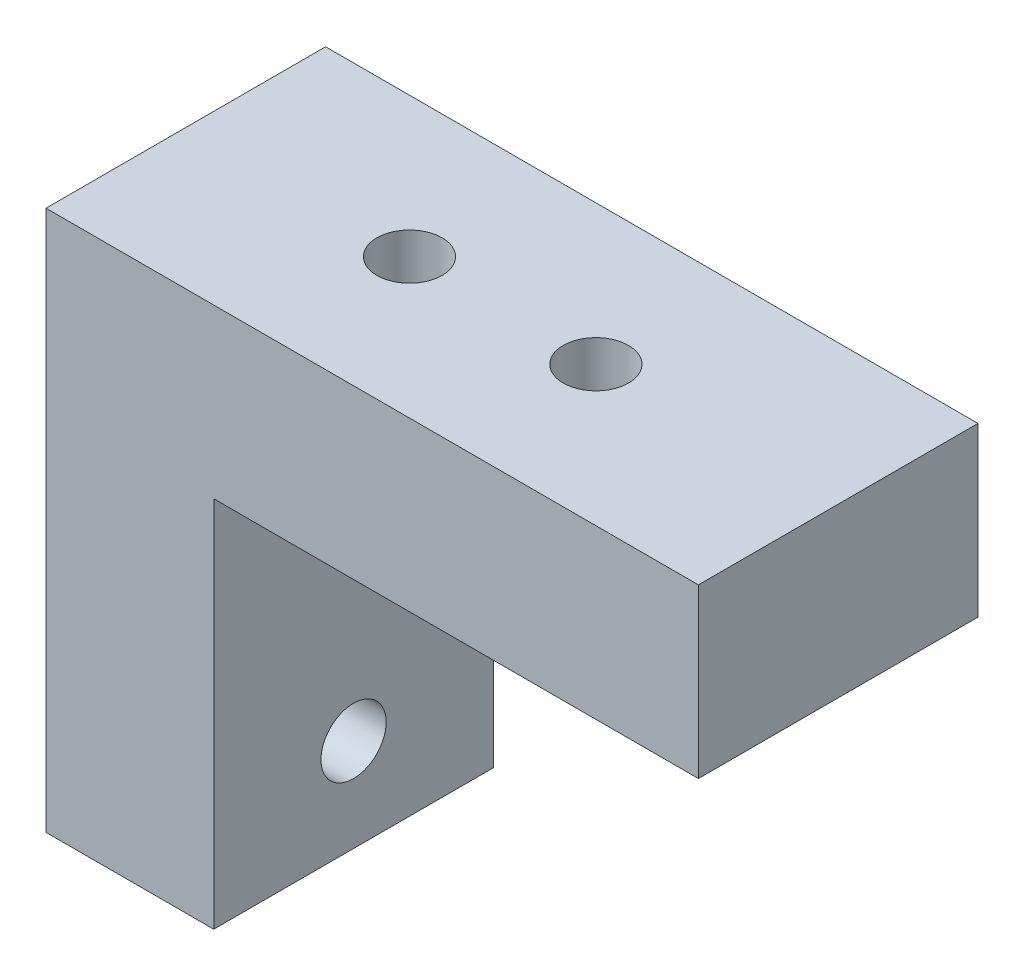
from build123d import *

# Parameters (mm, degrees)
SKETCH2_W           = 15
SKETCH2_H           = 20
BOSS_EXTRUDE1_DEPTH = 9
SKETCH3_R           = 1.75
CUT_EXTRUDE1_DEPTH  = 18.400072003
SKETCH4_W           = 35
SKETCH4_H           = 15
BOSS_EXTRUDE2_DEPTH = 9
SKETCH5_R           = 1.75
CUT_EXTRUDE2_DEPTH  = 47.61728645


with BuildPart() as part:
    # Sketch2 → Boss-Extrude1 (new body)
    with BuildSketch(Plane(origin=(0, 0, 0), x_dir=(0, 0, -1), z_dir=(1, 0, 0))):
        with Locations((2.852361856, -0.704723711)):
            Rectangle(SKETCH2_W, SKETCH2_H)
    extrude(amount=BOSS_EXTRUDE1_DEPTH)

    # Sketch3 → Cut-Extrude1 (cut, through all)
    with BuildSketch(Plane(origin=(9, 0, 0), x_dir=(0, 0, -1), z_dir=(1, 0, 0))):
        with Locations((2.852361856, -5.704723711)):
            Circle(SKETCH3_R)
        with Locations((2.852361856, 4.295276289)):
            Circle(SKETCH3_R)
    extrude(amount=-CUT_EXTRUDE1_DEPTH, mode=Mode.SUBTRACT)

    # Sketch4 → Boss-Extrude2 (add)
    with BuildSketch(Plane(origin=(0, 9.295276289, 0), x_dir=(1, 0, 0), z_dir=(0, 1, 0))):
        with Locations((17.5, 2.852361856)):
            Rectangle(SKETCH4_W, SKETCH4_H)
    extrude(amount=BOSS_EXTRUDE2_DEPTH)

    # Sketch5 → Cut-Extrude2 (cut, through all)
    with BuildSketch(Plane(origin=(0, 18.295276289, 0), x_dir=(1, 0, 0), z_dir=(0, 1, 0))):
        with Locations(Location((12, 2.852361856, 0), (0, 0, 270))):
            Circle(SKETCH5_R)
        with Locations(Location((22, 2.852361856, 0), (0, 0, 270))):
            Circle(SKETCH5_R)
    extrude(amount=-CUT_EXTRUDE2_DEPTH, mode=Mode.SUBTRACT)


solid = part.part
